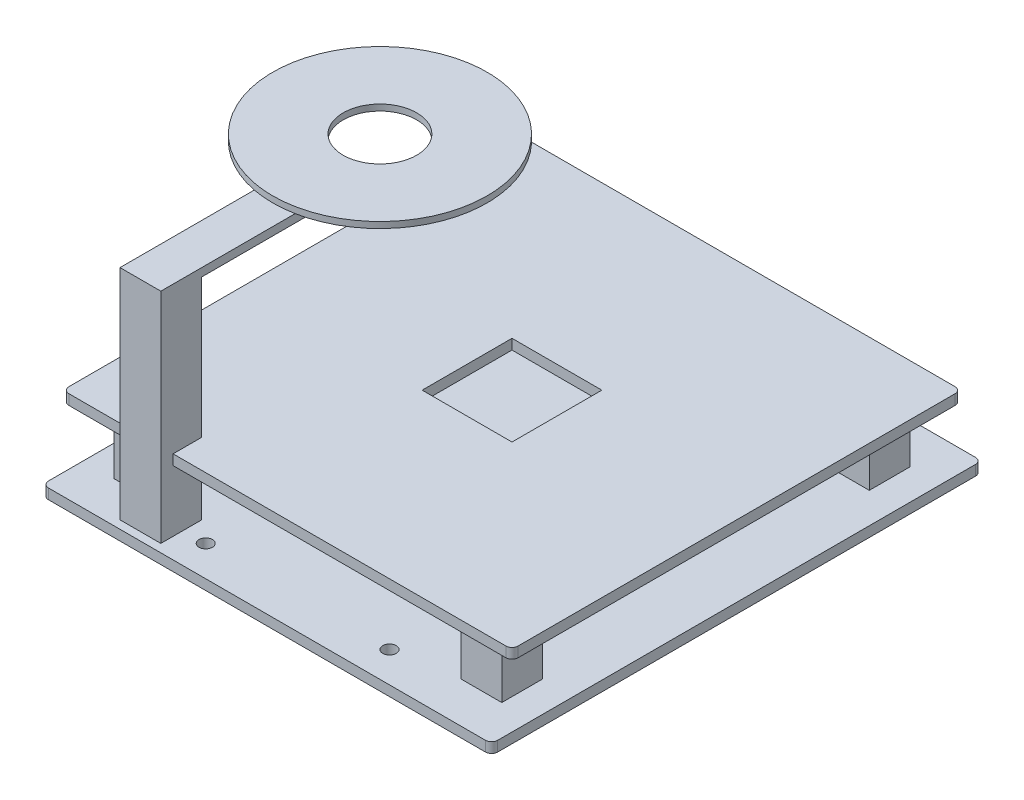
from build123d import *

# Parameters (mm, degrees)
BASE_PLATE_PROFILE_W       = 220
BASE_PLATE_PROFILE_H       = 240
BASE_PLATE_DEPTH           = 5
STANDOFFS_START            = 5
STANDOFFS_PROFILE_W        = 20
STANDOFFS_PROFILE_H        = 20
STANDOFFS_DEPTH            = 30
HOLDER_START               = 35
HOLDER_SEAT_PROFILE_W      = 220
HOLDER_SEAT_PROFILE_H      = 220
HOLDER_SEAT_PROFILE_W_2    = 44
HOLDER_SEAT_PROFILE_H_2    = 44
HOLDER_SEAT_DEPTH          = 5
GUIDE_START                = 5
GUIDE_COLUMN_PROFILE_W     = 20
GUIDE_COLUMN_PROFILE_H     = 20
GUIDE_COLUMN_DEPTH         = 107
GUIDE_START_2              = 108
GUIDE_ARM_PROFILE_W        = 20
GUIDE_ARM_PROFILE_H        = 77.313861244
GUIDE_ARM_DEPTH            = 4
GUIDE_START_3              = 112
GUIDE_SEAT_PROFILE_R       = 52.5
GUIDE_SEAT_PROFILE_R_2     = 18
GUIDE_SEAT_DEPTH           = 3
BASE_START                 = 2.5
BASE_FIXING_HOLES_LAYOUT_R = 3.3
BASE_FIXING_HOLES_DEPTH    = 2.5
PLATE_CORNER_RADII_R       = 3


with BuildPart() as part:
    # Base Plate Profile → Base Plate (new body)
    with BuildSketch(Plane(origin=(0, 0, 0), x_dir=(1, 0, 0), z_dir=(0, 1, 0))):
        Rectangle(BASE_PLATE_PROFILE_W, BASE_PLATE_PROFILE_H)
    extrude(amount=BASE_PLATE_DEPTH)

    # Standoffs Profile → Standoffs (add)
    with BuildSketch(Plane(origin=(0, 0, 0), x_dir=(1, 0, 0), z_dir=(0, 1, 0)).offset(STANDOFFS_START)):
        with Locations((-85, 90)):
            Rectangle(STANDOFFS_PROFILE_W, STANDOFFS_PROFILE_H)
        with Locations((-85, -90)):
            Rectangle(STANDOFFS_PROFILE_W, STANDOFFS_PROFILE_H)
        with Locations((85, 90)):
            Rectangle(STANDOFFS_PROFILE_W, STANDOFFS_PROFILE_H)
        with Locations((85, -90)):
            Rectangle(STANDOFFS_PROFILE_W, STANDOFFS_PROFILE_H)
    extrude(amount=STANDOFFS_DEPTH)

    # Holder Seat Profile → Holder Seat (add)
    with BuildSketch(Plane(origin=(0, 0, 0), x_dir=(1, 0, 0), z_dir=(0, 1, 0)).offset(HOLDER_START)):
        Rectangle(HOLDER_SEAT_PROFILE_W, HOLDER_SEAT_PROFILE_H)
        Rectangle(HOLDER_SEAT_PROFILE_W_2, HOLDER_SEAT_PROFILE_H_2, mode=Mode.SUBTRACT)
    extrude(amount=HOLDER_SEAT_DEPTH)

    # Guide Column Profile → Guide Column (add)
    with BuildSketch(Plane(origin=(0, 0, 0), x_dir=(1, 0, 0), z_dir=(0, 1, 0)).offset(GUIDE_START)):
        with Locations((-65.986921194, -106)):
            Rectangle(GUIDE_COLUMN_PROFILE_W, GUIDE_COLUMN_PROFILE_H)
    extrude(amount=GUIDE_COLUMN_DEPTH)

    # Guide Arm Profile → Guide Arm (add)
    with BuildSketch(Plane(origin=(0, 0, 0), x_dir=(1, 0, 0), z_dir=(0, 1, 0)).offset(GUIDE_START_2)):
        with Locations((-65.986921194, -77.343069378)):
            Rectangle(GUIDE_ARM_PROFILE_W, GUIDE_ARM_PROFILE_H)
    extrude(amount=GUIDE_ARM_DEPTH)

    # Guide Seat Profile → Guide Seat (add)
    with BuildSketch(Plane(origin=(0, 0, 0), x_dir=(1, 0, 0), z_dir=(0, 1, 0)).offset(GUIDE_START_3)):
        with Locations(Location((-65.986921194, 1.313861244, 0), (0, 0, 259.019424572))):
            Circle(GUIDE_SEAT_PROFILE_R)
        with Locations(Location((-65.986921194, 1.313861244, 0), (0, 0, 270))):
            Circle(GUIDE_SEAT_PROFILE_R_2, mode=Mode.SUBTRACT)
    extrude(amount=GUIDE_SEAT_DEPTH)

    # Base Fixing Holes Layout → Base Fixing Holes (cut, symmetric)
    with BuildSketch(Plane(origin=(0, 0, 0), x_dir=(1, 0, 0), z_dir=(0, 1, 0)).offset(BASE_START)):
        with Locations(Location((-45, 105, 0), (0, 0, 270))):
            Circle(BASE_FIXING_HOLES_LAYOUT_R)
        with Locations(Location((-45, -105, 0), (0, 0, 270))):
            Circle(BASE_FIXING_HOLES_LAYOUT_R)
        with Locations(Location((45, 105, 0), (0, 0, 270))):
            Circle(BASE_FIXING_HOLES_LAYOUT_R)
        with Locations(Location((45, -105, 0), (0, 0, 270))):
            Circle(BASE_FIXING_HOLES_LAYOUT_R)
    extrude(amount=BASE_FIXING_HOLES_DEPTH, both=True, mode=Mode.SUBTRACT)

    # Plate Corner Radii
    plate_corner_radii_edges = [part.edges().sort_by_distance(p)[0] for p in [
        (-110, 37.5, -110),
        (-110, 37.5, 110),
        (110, 37.5, 110),
        (110, 37.5, -110),
        (-110, 2.5, -120),
        (110, 2.5, -120),
        (110, 2.5, 120),
        (-110, 2.5, 120),
    ]]
    fillet(plate_corner_radii_edges, radius=PLATE_CORNER_RADII_R)


solid = part.part
